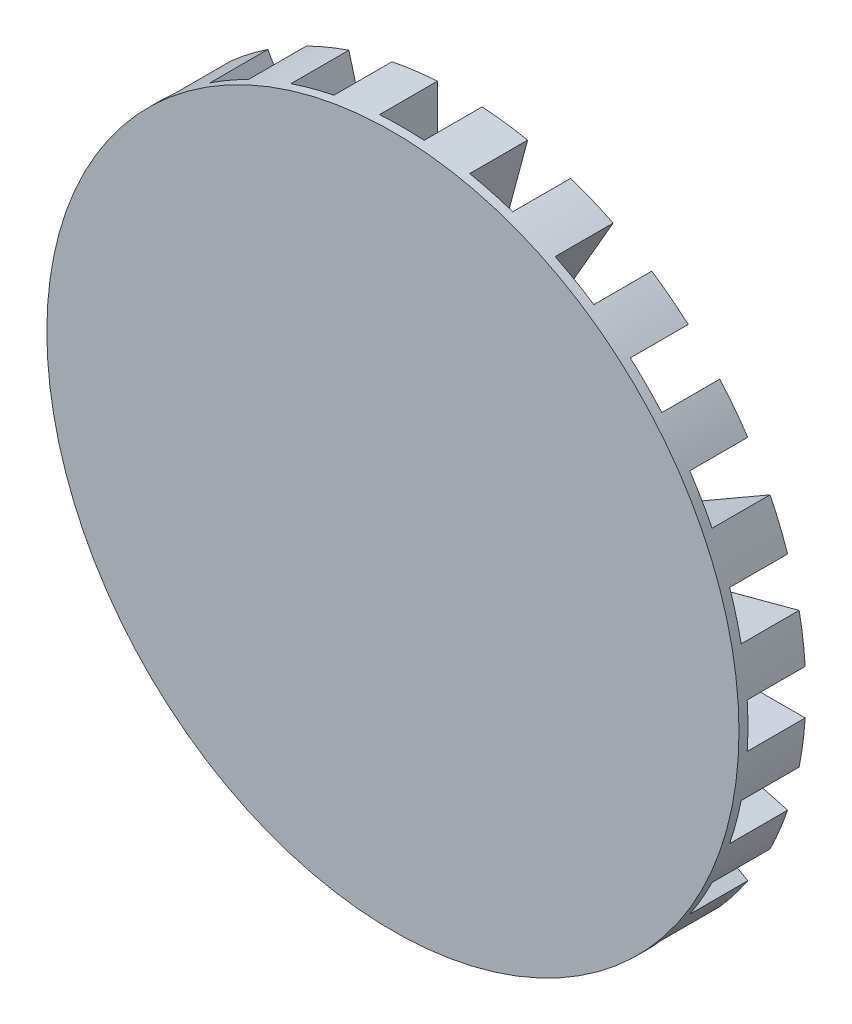
from build123d import *

# Parameters (mm, degrees)
BOSS_EXTRUDE1_START = 13
SKETCH1_R           = 77.607695155
BOSS_EXTRUDE1_DEPTH = 2
BOSS_EXTRUDE2_START = -15
BOSS_EXTRUDE2_DEPTH = 15
CIRPATTERN1_COUNT   = 24


with BuildPart() as part:
    # Sketch1 → Boss-Extrude1 (new body)
    with BuildSketch(Plane.XY.offset(BOSS_EXTRUDE1_START)):
        Circle(SKETCH1_R)
    extrude(amount=BOSS_EXTRUDE1_DEPTH)

    # Sketch3 → Boss-Extrude2 (add)
    with BuildSketch(Plane.XY.offset(15).offset(BOSS_EXTRUDE2_START)):
        with BuildLine():
            Line((-5, -77.446461166), (-5, -37.978770564))
            Line((-5, -37.978770564), (-15.214989994, -76.101632221))
            ThreePointArc((-15.214989994, -76.101632221), (-10.129836936, -76.943750564), (-5, -77.446461166))
        make_face()
    boss_extrude2 = extrude(amount=BOSS_EXTRUDE2_DEPTH)

    # CirPattern1: Boss-Extrude2 ×24 about axis
    cirpattern1_axis = Axis((0, 0, 0), (0, 0, 1))
    for i in range(1, CIRPATTERN1_COUNT):
        add(boss_extrude2.rotate(cirpattern1_axis, i * 360 / CIRPATTERN1_COUNT))


solid = part.part
